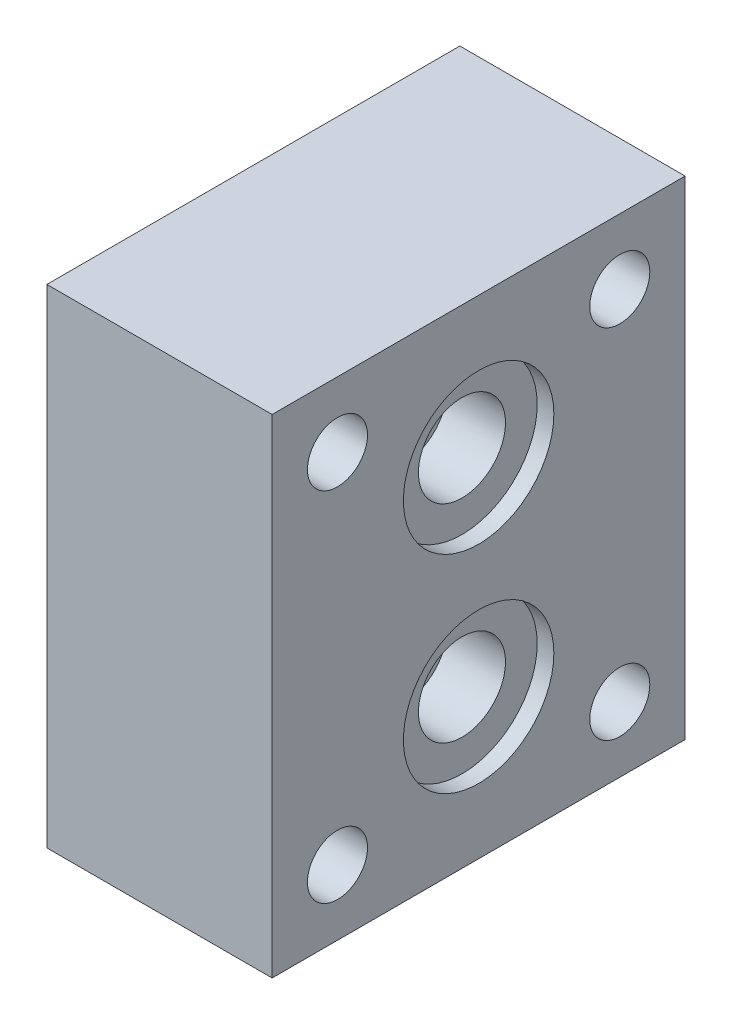
from build123d import *

# Parameters (mm, degrees)
SKETCH1_W           = 82.55
SKETCH1_H           = 69.85
BOSS_EXTRUDE1_DEPTH = 38.1
CUT_EXTRUDE2_START  = 38.1
SKETCH2_R           = 5.08
CUT_EXTRUDE2_DEPTH  = 153.752235041
CUT_EXTRUDE4_START  = 38.1
SKETCH3_R           = 5.08
CUT_EXTRUDE4_DEPTH  = 153.752235041
CUT_EXTRUDE6_START  = 38.1
SKETCH4_R           = 7.366
CUT_EXTRUDE6_DEPTH  = 12.7
CUT_EXTRUDE8_START  = 38.1
SKETCH5_R           = 12.7254
CUT_EXTRUDE8_DEPTH  = 2.8194
CUT_EXTRUDE10_START = 38.1
SKETCH6_R           = 7.366
CUT_EXTRUDE10_DEPTH = 12.7
CUT_EXTRUDE12_START = 38.1
SKETCH7_R           = 12.7254
CUT_EXTRUDE12_DEPTH = 2.8194


with BuildPart() as part:
    # Sketch1 → Boss-Extrude1 (new body)
    with BuildSketch(Plane.YZ):
        with Locations((41.275, 34.925)):
            Rectangle(SKETCH1_W, SKETCH1_H)
    extrude(amount=BOSS_EXTRUDE1_DEPTH)

    # Sketch2 → Cut-Extrude2 (cut, through all)
    with BuildSketch(Plane.YZ.offset(CUT_EXTRUDE2_START)):
        with Locations(Location((11.049, 11.049, 0), (0, 0, 270))):
            Circle(SKETCH2_R)
    extrude(amount=-CUT_EXTRUDE2_DEPTH, mode=Mode.SUBTRACT)

    # Sketch3 → Cut-Extrude4 (cut, through all)
    with BuildSketch(Plane.YZ.offset(CUT_EXTRUDE4_START)):
        with Locations(Location((71.501, 11.049, 0), (0, 0, 270))):
            Circle(SKETCH3_R)
        with Locations(Location((11.049, 58.801, 0), (0, 0, 270))):
            Circle(SKETCH3_R)
        with Locations(Location((71.501, 58.801, 0), (0, 0, 270))):
            Circle(SKETCH3_R)
    extrude(amount=-CUT_EXTRUDE4_DEPTH, mode=Mode.SUBTRACT)

    # Sketch4 → Cut-Extrude6 (cut)
    with BuildSketch(Plane.YZ.offset(CUT_EXTRUDE6_START)):
        with Locations(Location((23.749, 34.925, 0), (0, 0, 270))):
            Circle(SKETCH4_R)
    extrude(amount=-CUT_EXTRUDE6_DEPTH, mode=Mode.SUBTRACT)

    # Sketch5 → Cut-Extrude8 (cut)
    with BuildSketch(Plane.YZ.offset(CUT_EXTRUDE8_START)):
        with Locations(Location((23.749, 34.925, 0), (0, 0, 270))):
            Circle(SKETCH5_R)
    extrude(amount=-CUT_EXTRUDE8_DEPTH, mode=Mode.SUBTRACT)

    # Sketch6 → Cut-Extrude10 (cut)
    with BuildSketch(Plane.YZ.offset(CUT_EXTRUDE10_START)):
        with Locations(Location((58.801, 34.925, 0), (0, 0, 270))):
            Circle(SKETCH6_R)
    extrude(amount=-CUT_EXTRUDE10_DEPTH, mode=Mode.SUBTRACT)

    # Sketch7 → Cut-Extrude12 (cut)
    with BuildSketch(Plane.YZ.offset(CUT_EXTRUDE12_START)):
        with Locations(Location((58.801, 34.925, 0), (0, 0, 270))):
            Circle(SKETCH7_R)
    extrude(amount=-CUT_EXTRUDE12_DEPTH, mode=Mode.SUBTRACT)


solid = part.part
